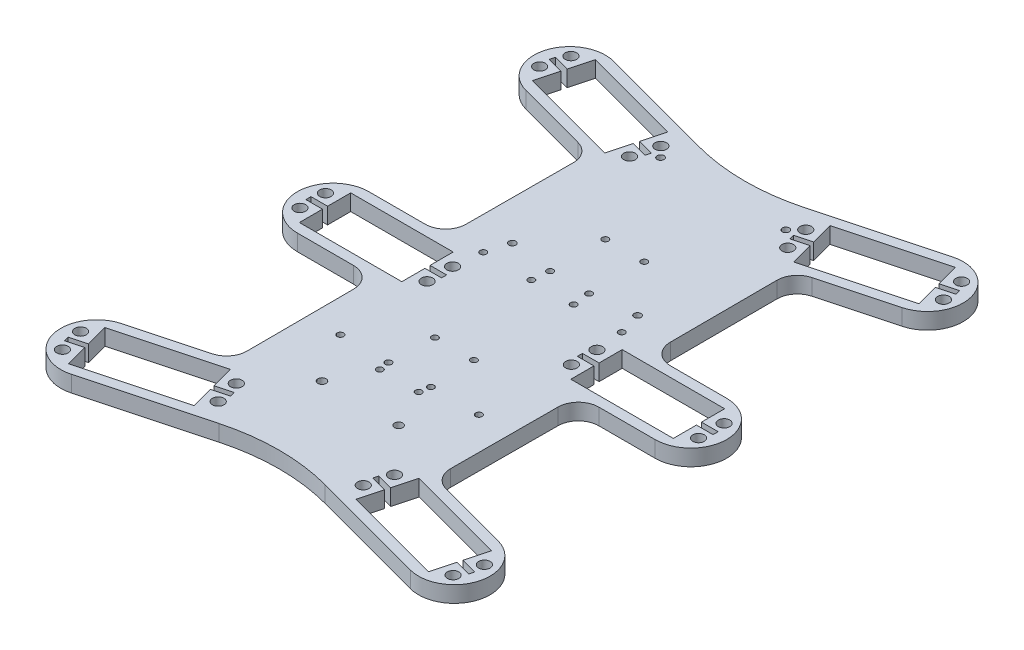
from build123d import *

# Parameters (mm, degrees)
SKETCH1_R           = 2.25
SKETCH1_W           = 40.1
SKETCH1_H           = 20.1
BOSS_EXTRUDE1_DEPTH = 6.35
FILLET1_R           = 80
FILLET2_R           = 8
SKETCH5_W           = 6.5
SKETCH5_H           = 2
CUT_EXTRUDE2_DEPTH  = 136.852736293
SKETCH6_R           = 1.25
SKETCH6_R_2         = 1.35
CUT_EXTRUDE3_DEPTH  = 10
SKETCH7_R           = 1.25
CUT_EXTRUDE4_DEPTH  = 10
SKETCH8_R           = 1.6
CUT_EXTRUDE5_DEPTH  = 10


with BuildPart() as part:
    # Sketch1 → Boss-Extrude1 (new body)
    with BuildSketch(Plane(origin=(0, 0, 0), x_dir=(1, 0, 0), z_dir=(0, 1, 0))):
        with BuildLine():
            Line((-70, 14), (-40, 14))
            Line((-40, 14), (-39.816062711, 70))
            Line((-39.816062711, 70), (-73.623466631, 79.058666579))
            ThreePointArc((-73.623466631, 79.058666579), (-83.522961568, 96.205094778), (-66.376533369, 106.104589715))
            Line((-66.376533369, 106.104589715), (0, 88.319051202))
            Line((0, 88.319051202), (66.376533369, 106.104589715))
            ThreePointArc((66.376533369, 106.104589715), (83.522961568, 96.205094778), (73.623466631, 79.058666579))
            Line((73.623466631, 79.058666579), (39.816062711, 70))
            Line((39.816062711, 70), (40, 14))
            Line((40, 14), (70, 14))
            ThreePointArc((70, 14), (84, 0), (70, -14))
            Line((70, -14), (40, -14))
            Line((40, -14), (39.816062711, -70))
            Line((39.816062711, -70), (73.623466631, -79.058666579))
            ThreePointArc((73.623466631, -79.058666579), (83.522961568, -96.205094778), (66.376533369, -106.104589715))
            Line((66.376533369, -106.104589715), (0, -88.319051202))
            Line((0, -88.319051202), (-66.376533369, -106.104589715))
            ThreePointArc((-66.376533369, -106.104589715), (-83.522961568, -96.205094778), (-73.623466631, -79.058666579))
            Line((-73.623466631, -79.058666579), (-39.816062711, -70))
            Line((-39.816062711, -70), (-40, -14))
            Line((-40, -14), (-70, -14))
            ThreePointArc((-70, -14), (-84, 0), (-70, 14))
        make_face()
        with Locations(Location((-76.433311385, 99.481809639, 0), (0, 0, 270))):
            Circle(SKETCH1_R, mode=Mode.SUBTRACT)
        with Locations(Location((-79.021501836, 89.822551376, 0), (0, 0, 270))):
            Circle(SKETCH1_R, mode=Mode.SUBTRACT)
        with Locations(Location((-78, 5, 0), (0, 0, 270))):
            Circle(SKETCH1_R, mode=Mode.SUBTRACT)
        with Locations(Location((-79.021501836, -89.822551376, 0), (0, 0, 90))):
            Circle(SKETCH1_R, mode=Mode.SUBTRACT)
        with Locations(Location((-76.433311385, -99.481809639, 0), (0, 0, 90))):
            Circle(SKETCH1_R, mode=Mode.SUBTRACT)
        with Locations(Location((-78, -5, 0), (0, 0, 270))):
            Circle(SKETCH1_R, mode=Mode.SUBTRACT)
        with Locations(Location((78, -5, 0), (0, 0, 90))):
            Circle(SKETCH1_R, mode=Mode.SUBTRACT)
        with Locations(Location((76.433311385, -99.481809639, 0), (0, 0, 270))):
            Circle(SKETCH1_R, mode=Mode.SUBTRACT)
        with Locations(Location((79.021501836, -89.822551376, 0), (0, 0, 270))):
            Circle(SKETCH1_R, mode=Mode.SUBTRACT)
        with Locations(Location((78, 5, 0), (0, 0, 90))):
            Circle(SKETCH1_R, mode=Mode.SUBTRACT)
        with Locations(Location((79.021501836, 89.822551376, 0), (0, 0, 90))):
            Circle(SKETCH1_R, mode=Mode.SUBTRACT)
        with Locations(Location((76.433311385, 99.481809639, 0), (0, 0, 90))):
            Circle(SKETCH1_R, mode=Mode.SUBTRACT)
        with Locations(Location((-30.95703272, 76.943715692, 0), (0, 0, 90))):
            Circle(SKETCH1_R, mode=Mode.SUBTRACT)
        with Locations(Location((-28.368842269, 86.602973955, 0), (0, 0, 90))):
            Circle(SKETCH1_R, mode=Mode.SUBTRACT)
        with Locations(Location((-28.24, -5, 0), (0, 0, 90))):
            Circle(SKETCH1_R, mode=Mode.SUBTRACT)
        with Locations(Location((-28.24, 5, 0), (0, 0, 90))):
            Circle(SKETCH1_R, mode=Mode.SUBTRACT)
        with Locations(Location((-28.368842269, -86.602973955, 0), (0, 0, 270))):
            Circle(SKETCH1_R, mode=Mode.SUBTRACT)
        with Locations(Location((-30.95703272, -76.943715692, 0), (0, 0, 270))):
            Circle(SKETCH1_R, mode=Mode.SUBTRACT)
        with Locations(Location((28.368842269, 86.602973955, 0), (0, 0, 270))):
            Circle(SKETCH1_R, mode=Mode.SUBTRACT)
        with Locations(Location((30.95703272, 76.943715692, 0), (0, 0, 270))):
            Circle(SKETCH1_R, mode=Mode.SUBTRACT)
        with Locations(Location((28.24, 5, 0), (0, 0, 270))):
            Circle(SKETCH1_R, mode=Mode.SUBTRACT)
        with Locations(Location((28.24, -5, 0), (0, 0, 270))):
            Circle(SKETCH1_R, mode=Mode.SUBTRACT)
        with Locations(Location((30.95703272, -76.943715692, 0), (0, 0, 90))):
            Circle(SKETCH1_R, mode=Mode.SUBTRACT)
        with Locations(Location((28.368842269, -86.602973955, 0), (0, 0, 90))):
            Circle(SKETCH1_R, mode=Mode.SUBTRACT)
        Polygon((-70.460853466, 103.109639074), (-75.663116273, 83.694529965), (-36.929490638, 73.315886257), (-31.727227832, 92.730995365), align=None, mode=Mode.SUBTRACT)
        with Locations((-53.12, 0)):
            Rectangle(SKETCH1_W, SKETCH1_H, mode=Mode.SUBTRACT)
        Polygon((-36.929490638, -73.315886257), (-31.727227832, -92.730995365), (-70.460853466, -103.109639074), (-75.663116273, -83.694529965), align=None, mode=Mode.SUBTRACT)
        Polygon((36.929490638, 73.315886257), (31.727227832, 92.730995365), (70.460853466, 103.109639074), (75.663116273, 83.694529965), align=None, mode=Mode.SUBTRACT)
        with Locations((53.12, 0)):
            Rectangle(SKETCH1_W, SKETCH1_H, mode=Mode.SUBTRACT)
        Polygon((36.929490638, -73.315886257), (31.727227832, -92.730995365), (70.460853466, -103.109639074), (75.663116273, -83.694529965), align=None, mode=Mode.SUBTRACT)
    extrude(amount=BOSS_EXTRUDE1_DEPTH)

    # Fillet1
    fillet1_edges = [part.edges().sort_by_distance(p)[0] for p in [
        (0, 3.175, -88.319051202),
        (0, 3.175, 88.319051202),
    ]]
    fillet(fillet1_edges, radius=FILLET1_R)

    # Fillet2
    fillet2_edges = [part.edges().sort_by_distance(p)[0] for p in [
        (-40, 3.175, -14),
        (-39.816062711, 3.175, -70),
        (39.816062711, 3.175, -70),
        (40, 3.175, -14),
        (40, 3.175, 14),
        (39.816062711, 3.175, 70),
        (-39.816062711, 3.175, 70),
        (-40, 3.175, 14),
    ]]
    fillet(fillet2_edges, radius=FILLET2_R)

    # Sketch5 → Cut-Extrude2 (cut, through all)
    with BuildSketch(Plane(origin=(0, 6.35, 0), x_dir=(1, 0, 0), z_dir=(0, 1, 0))):
        with Locations((-29.82, 0)):
            Rectangle(SKETCH5_W, SKETCH5_H)
        with Locations((-76.42, 0)):
            Rectangle(SKETCH5_W, SKETCH5_H)
        Polygon((-34.06954019, 83.989366637), (-27.791022319, 82.307042844), (-28.308660409, 80.375191192), (-34.58717828, 82.057514985), align=None)
        Polygon((-72.803165824, 94.368010346), (-73.320803914, 92.436158693), (-79.599321785, 94.118482486), (-79.081683695, 96.050334139), align=None)
        Polygon((72.803165824, 94.368010346), (79.081683695, 96.050334139), (79.599321785, 94.118482486), (73.320803914, 92.436158693), align=None)
        Polygon((34.06954019, 83.989366637), (34.58717828, 82.057514985), (28.308660409, 80.375191192), (27.791022319, 82.307042844), align=None)
        with Locations((76.42, 0)):
            Rectangle(SKETCH5_W, SKETCH5_H)
        with Locations((29.82, 0)):
            Rectangle(SKETCH5_W, SKETCH5_H)
        Polygon((34.06954019, -83.989366637), (27.791022319, -82.307042844), (28.308660409, -80.375191192), (34.58717828, -82.057514985), align=None)
        Polygon((72.803165824, -94.368010346), (73.320803914, -92.436158693), (79.599321785, -94.118482486), (79.081683695, -96.050334139), align=None)
        Polygon((-72.803165824, -94.368010346), (-79.081683695, -96.050334139), (-79.599321785, -94.118482486), (-73.320803914, -92.436158693), align=None)
        Polygon((-34.06954019, -83.989366637), (-34.58717828, -82.057514985), (-28.308660409, -80.375191192), (-27.791022319, -82.307042844), align=None)
    extrude(amount=-CUT_EXTRUDE2_DEPTH, mode=Mode.SUBTRACT)

    # Sketch6 → Cut-Extrude3 (cut)
    with BuildSketch(Plane(origin=(0, 6.35, 0), x_dir=(1, 0, 0), z_dir=(0, 1, 0))):
        with Locations(Location((27.1, -40.058854365, 0), (0, 0, 270))):
            Circle(SKETCH6_R)
        with Locations(Location((8.3, -40.058854365, 0), (0, 0, 270))):
            Circle(SKETCH6_R)
        with Locations(Location((-8.3, -40.058854365, 0), (0, 0, 270))):
            Circle(SKETCH6_R)
        with Locations(Location((-27.1, -40.058854365, 0), (0, 0, 270))):
            Circle(SKETCH6_R)
        with Locations(Location((27.1, 15.841145635, 0), (0, 0, 270))):
            Circle(SKETCH6_R)
        with Locations(Location((-8.3, 15.841145635, 0), (0, 0, 270))):
            Circle(SKETCH6_R)
        with Locations(Location((-27.1, 15.841145635, 0), (0, 0, 270))):
            Circle(SKETCH6_R)
        with Locations(Location((-24.5, 24.641145635, 0), (0, 0, 270))):
            Circle(SKETCH6_R_2)
        with Locations(Location((24.5, 24.641145635, 0), (0, 0, 270))):
            Circle(SKETCH6_R_2)
        with Locations(Location((24.5, 82.641145635, 0), (0, 0, 270))):
            Circle(SKETCH6_R_2)
        with Locations(Location((-24.5, 82.641145635, 0), (0, 0, 270))):
            Circle(SKETCH6_R_2)
        with Locations(Location((8.3, 15.841145635, 0), (0, 0, 270))):
            Circle(SKETCH6_R)
    extrude(amount=-CUT_EXTRUDE3_DEPTH, mode=Mode.SUBTRACT)

    # Sketch7 → Cut-Extrude4 (cut)
    with BuildSketch(Plane.XZ):
        with Locations(Location((-7.62, 44.13, 0), (0, 0, 270))):
            Circle(SKETCH7_R)
        with Locations(Location((7.62, 44.13, 0), (0, 0, 270))):
            Circle(SKETCH7_R)
        with Locations(Location((7.62, 22.54, 0), (0, 0, 270))):
            Circle(SKETCH7_R)
        with Locations(Location((-7.62, 22.54, 0), (0, 0, 270))):
            Circle(SKETCH7_R)
        with Locations(Location((7.62, -22.54, 0), (0, 0, 270))):
            Circle(SKETCH7_R)
        with Locations(Location((7.62, -44.13, 0), (0, 0, 270))):
            Circle(SKETCH7_R)
        with Locations(Location((-7.62, -22.54, 0), (0, 0, 270))):
            Circle(SKETCH7_R)
        with Locations(Location((-7.62, -44.13, 0), (0, 0, 270))):
            Circle(SKETCH7_R)
    extrude(amount=-CUT_EXTRUDE4_DEPTH, mode=Mode.SUBTRACT)

    # Sketch8 → Cut-Extrude5 (cut)
    with BuildSketch(Plane(origin=(0, 6.35, 0), x_dir=(1, 0, 0), z_dir=(0, 1, 0))):
        with Locations(Location((15, -59.358854365, 0), (0, 0, 270))):
            Circle(SKETCH8_R)
        with Locations(Location((-15, -59.358854365, 0), (0, 0, 270))):
            Circle(SKETCH8_R)
    extrude(amount=-CUT_EXTRUDE5_DEPTH, mode=Mode.SUBTRACT)


solid = part.part
